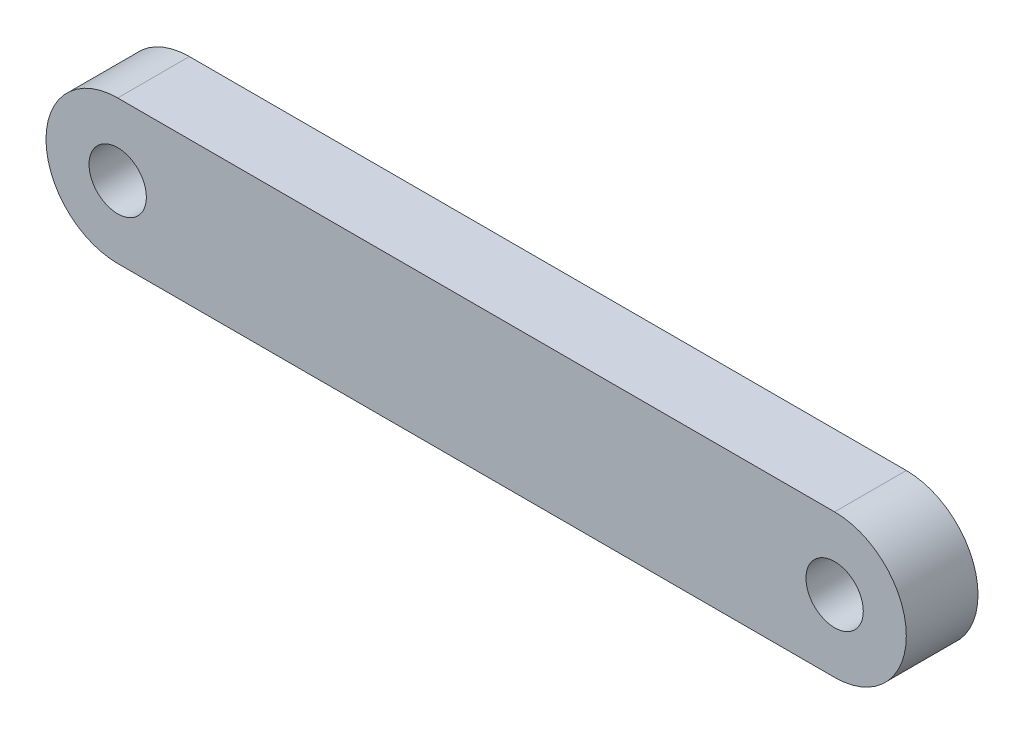
from build123d import *

# Parameters (mm, degrees)
SKETCH_2_R      = 2
EXTRUDE_1_DEPTH = 2.5


with BuildPart() as part:
    # 草圖2 → 填料-伸長1 (new, symmetric)
    with BuildSketch(Plane.XY):
        with BuildLine():
            Line((-25, 5), (25, 5))
            ThreePointArc((25, 5), (30, 0), (25, -5))
            Line((25, -5), (-25, -5))
            ThreePointArc((-25, -5), (-30, 0), (-25, 5))
        make_face()
        with Locations((25, 0)):
            Circle(SKETCH_2_R, mode=Mode.SUBTRACT)
        with Locations((-25, 0)):
            Circle(SKETCH_2_R, mode=Mode.SUBTRACT)
    extrude(amount=EXTRUDE_1_DEPTH, both=True)


solid = part.part
